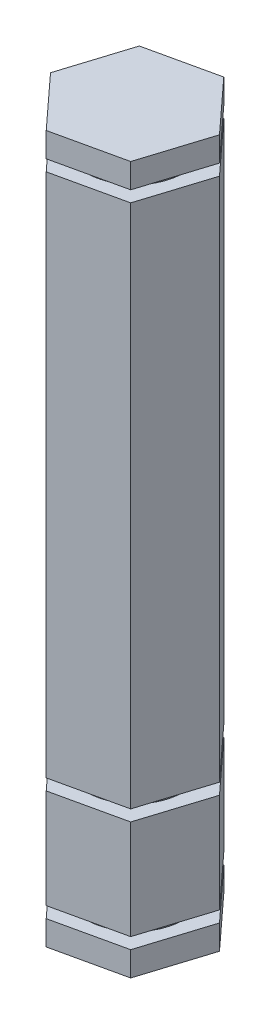
from build123d import *

# Parameters (mm, degrees)
BOSS_EXTRUDE1_DEPTH = 54.356
SKETCH2_R           = 5.0292
BOSS_EXTRUDE2_DEPTH = 1.1684
BOSS_EXTRUDE3_DEPTH = 2.54
BOSS_EXTRUDE4_START = 1.1684
SKETCH4_R           = 5.0292
BOSS_EXTRUDE4_DEPTH = 1.1684
BOSS_EXTRUDE5_DEPTH = 10.287
BOSS_EXTRUDE6_START = 1.1684
SKETCH6_R           = 5.0292
BOSS_EXTRUDE6_DEPTH = 1.1684
BOSS_EXTRUDE7_DEPTH = 2.54


with BuildPart() as part:
    # Sketch1 → Boss-Extrude1 (new body)
    with BuildSketch(Plane(origin=(0, 0, 0), x_dir=(1, 0, 0), z_dir=(0, 1, 0))):
        Polygon((4.957467016, -5.40248592), (7.157423558, 1.592049415), (2.199956542, 6.994535335), (-4.957467016, 5.40248592), (-7.157423558, -1.592049415), (-2.199956542, -6.994535335), align=None)
    extrude(amount=BOSS_EXTRUDE1_DEPTH)

    # Sketch2 → Boss-Extrude2 (add)
    with BuildSketch(Plane(origin=(0, 54.356, 0), x_dir=(1, 0, 0), z_dir=(0, 1, 0))):
        with Locations(Location((0, 0, 0), (0, 0, 270))):
            Circle(SKETCH2_R)
    extrude(amount=BOSS_EXTRUDE2_DEPTH)

    # Sketch3 → Boss-Extrude3 (add)
    with BuildSketch(Plane(origin=(0, 55.5244, 0), x_dir=(1, 0, 0), z_dir=(0, 1, 0))):
        Polygon((-2.199956542, -6.994535335), (4.957467016, -5.40248592), (7.157423558, 1.592049415), (2.199956542, 6.994535335), (-4.957467016, 5.40248592), (-7.157423558, -1.592049415), align=None)
    extrude(amount=BOSS_EXTRUDE3_DEPTH)

    # Sketch4 → Boss-Extrude4 (add)
    with BuildSketch(Plane.XZ.offset(BOSS_EXTRUDE4_START)):
        with Locations(Location((0, 0, 0), (0, 0, 90))):
            Circle(SKETCH4_R)
    extrude(amount=-BOSS_EXTRUDE4_DEPTH)

    # Sketch5 → Boss-Extrude5 (add)
    with BuildSketch(Plane.XZ.offset(1.1684)):
        Polygon((4.957467016, 5.40248592), (-2.199956542, 6.994535335), (-7.157423558, 1.592049415), (-4.957467016, -5.40248592), (2.199956542, -6.994535335), (7.157423558, -1.592049415), align=None)
    extrude(amount=BOSS_EXTRUDE5_DEPTH)

    # Sketch6 → Boss-Extrude6 (add)
    with BuildSketch(Plane.XZ.offset(11.4554).offset(BOSS_EXTRUDE6_START)):
        with Locations(Location((0, 0, 0), (0, 0, 90))):
            Circle(SKETCH6_R)
    extrude(amount=-BOSS_EXTRUDE6_DEPTH)

    # Sketch7 → Boss-Extrude7 (add)
    with BuildSketch(Plane.XZ.offset(12.6238)):
        Polygon((7.157423558, -1.592049415), (4.957467016, 5.40248592), (-2.199956542, 6.994535335), (-7.157423558, 1.592049415), (-4.957467016, -5.40248592), (2.199956542, -6.994535335), align=None)
    extrude(amount=BOSS_EXTRUDE7_DEPTH)


solid = part.part
